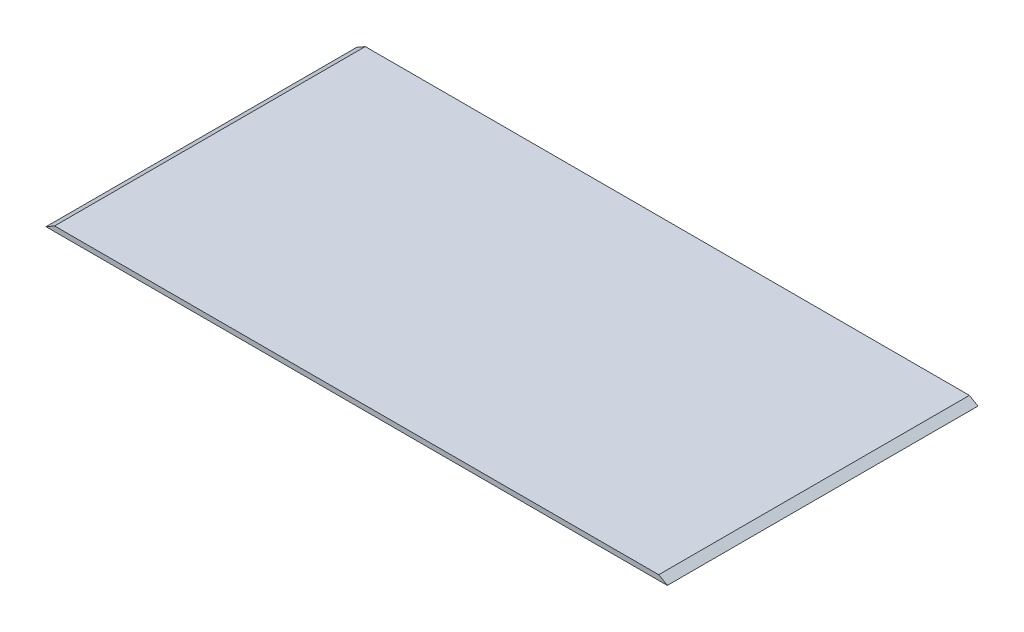
from build123d import *

# Parameters (mm, degrees)
SKETCH_1_W          = 250
SKETCH_1_H          = 250
EXTRUDE_1_DEPTH     = 2
SKETCH_2_W          = 250
SKETCH_2_H          = 125
CUT_EXTRUDE_1_DEPTH = 2
SKETCH_6_W          = 10
SKETCH_6_H          = 10
EXTRUDE_3_DEPTH     = 10
CUT_EXTRUDE_2_DEPTH = 178.059312096


with BuildPart() as part:
    # 草图1 → 凸台-拉伸1 (new body)
    with BuildSketch(Plane(origin=(0, 0, 0), x_dir=(1, 0, 0), z_dir=(0, 1, 0))):
        Rectangle(SKETCH_1_W, SKETCH_1_H)
    extrude(amount=EXTRUDE_1_DEPTH)

    # 草图2 → 切除-拉伸1 (cut)
    with BuildSketch(Plane(origin=(0, 2, 0), x_dir=(1, 0, 0), z_dir=(0, 1, 0))):
        with Locations((0, -62.5)):
            Rectangle(SKETCH_2_W, SKETCH_2_H)
    extrude(amount=-CUT_EXTRUDE_1_DEPTH, mode=Mode.SUBTRACT)

    # 草图6 → 凸台-拉伸3 (add)
    with BuildSketch(Plane.XZ):
        with Locations((-105.253353702, -19.703268914)):
            Rectangle(SKETCH_6_W, SKETCH_6_H)
        with Locations((-105.253353702, -104.703268914)):
            Rectangle(SKETCH_6_W, SKETCH_6_H)
        with Locations((104.746646298, -19.703268914)):
            Rectangle(SKETCH_6_W, SKETCH_6_H)
        with Locations((104.746646298, -104.703268914)):
            Rectangle(SKETCH_6_W, SKETCH_6_H)
    extrude(amount=EXTRUDE_3_DEPTH)

    # 草图7 → 切除-拉伸2 (cut, through all)
    with BuildSketch(Plane(origin=(0, 0, -125), x_dir=(-1, 0, 0), z_dir=(0, 0, -1))):
        Polygon((-125, 2), (-125, 0), (-121.535898385, 2), align=None)
        Polygon((121.535898385, 2), (125, 2), (125, 0), align=None)
    extrude(amount=-CUT_EXTRUDE_2_DEPTH, mode=Mode.SUBTRACT)


solid = part.part
